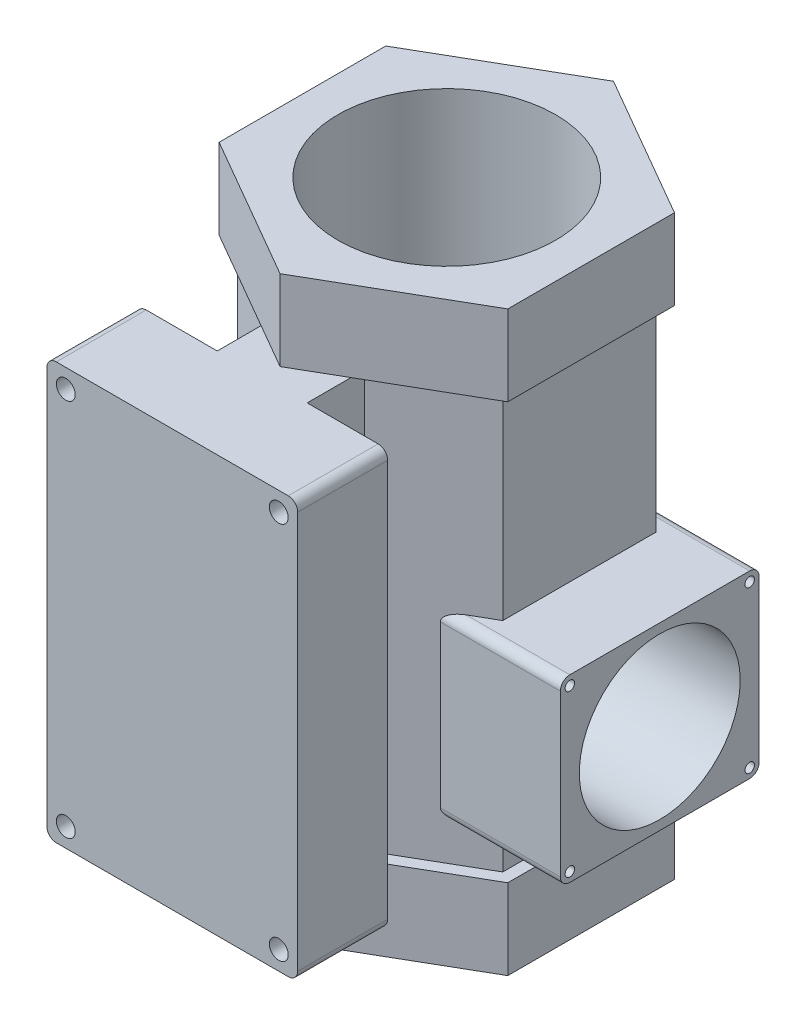
from build123d import *

# Parameters (mm, degrees)
EXTRUDE_1_DEPTH             = 85
EXTRUDE_798_DEPTH           = 440
EXTRUDE_2_DEPTH             = 85
EXTRUDE_1413_DEPTH          = 85
EXTRUDE_1413_DEPTH_BACK     = 140
SKETCH_10_W                 = 210
SKETCH_10_H                 = 190
SKETCH_5_R                  = 115
CUT_EXTRUDE_1475_DEPTH      = 712.91642768
CUT_EXTRUDE_1609_REACH      = 710.683
CUT_EXTRUDE_1609_END_RADIUS = 115
SKETCH_12_R                 = 85
CUT_EXTRUDE_2000_REACH      = 739.219
SKETCH_13_R                 = 10
SKETCH_14_R                 = 5
CUT_EXTRUDE_6_DEPTH         = 30
FILLET_2_R                  = 10
FILLET_3_R                  = 10


with BuildPart() as part:
    # Эскиз2 → Боковой многогранник 1 (new body)
    with BuildSketch(Plane(origin=(0, 0, 0), x_dir=(1, 0, 0), z_dir=(0, 1, 0))):
        Polygon((0, 176.091832103), (-152.5, 88.045916051), (-152.5, -88.045916051), (0, -176.091832103), (152.5, -88.045916051), (152.5, 88.045916051), align=None)
    extrude(amount=EXTRUDE_1_DEPTH)

    # Sketch 344 → Extrude 798 (add)
    with BuildSketch(Plane(origin=(0, 0, 0), x_dir=(1, 0, 0), z_dir=(0, 1, 0))):
        Polygon((0, 161.658075373), (-140, 80.829037687), (-140, -80.829037687), (-47.5, -134.233937587), (-47.5, -195), (-132.5, -195), (-132.5, -290), (132.5, -290), (132.5, -195), (47.5, -195), (47.5, -134.233937587), (140, -80.829037687), (140, 80.829037687), align=None)
    extrude(amount=-EXTRUDE_798_DEPTH)

    # Эскиз4 → Боковой многогранник 2 (add)
    with BuildSketch(Plane.XZ.offset(440)):
        Polygon((0, -176.091832103), (152.5, -88.045916051), (152.5, 88.045916051), (0, 176.091832103), (-152.5, 88.045916051), (-152.5, -88.045916051), align=None)
    extrude(amount=EXTRUDE_2_DEPTH)

    # Эскиз10 → Extrude 1413 (add, two sides: drawn at the far end of the back side and taken through both)
    with BuildSketch(Plane(origin=(140, 0, 0), x_dir=(0, 0, -1), z_dir=(1, 0, 0)).offset(-EXTRUDE_1413_DEPTH_BACK)):
        with Locations((0, -305)):
            Rectangle(SKETCH_10_W, SKETCH_10_H)
    extrude(amount=EXTRUDE_1413_DEPTH + EXTRUDE_1413_DEPTH_BACK)

    # Эскиз5 → Cut-Extrude 1475 (cut, through all)
    with BuildSketch(Plane(origin=(0, 85, 0), x_dir=(1, 0, 0), z_dir=(0, 1, 0))):
        with Locations(Location((0, 0, 0), (0, 0, 270))):
            Circle(SKETCH_5_R)
    extrude(amount=-CUT_EXTRUDE_1475_DEPTH, mode=Mode.SUBTRACT)

    # Cut-Extrude 1609: up to this cylinder (the profile starts outside it)
    cut_extrude_1609_end = Plane(origin=(0, -305, 0), z_dir=(0, 1, 0)) * Cylinder(CUT_EXTRUDE_1609_END_RADIUS, 1652.366, mode=Mode.PRIVATE)
    # Эскиз12 → Cut-Extrude 1609 (cut, up to the surface)
    with BuildSketch(Plane(origin=(225, 0, 0), x_dir=(0, 0, -1), z_dir=(1, 0, 0)), mode=Mode.PRIVATE) as cut_extrude_1609_sk1:
        with Locations((0, -305)):
            Circle(SKETCH_12_R)
    cut_extrude_1609_tool1 = extrude(cut_extrude_1609_sk1.sketch, amount=-CUT_EXTRUDE_1609_REACH, mode=Mode.PRIVATE) - cut_extrude_1609_end
    add(cut_extrude_1609_tool1.solids().sort_by_distance((225, -305, 0))[0], mode=Mode.SUBTRACT)

    # Эскиз13 → Cut-Extrude 2000 (cut, up to next)
    with BuildSketch(Plane.XY.offset(290), mode=Mode.PRIVATE) as cut_extrude_2000_sk1:
        with Locations((-112.5, -420)):
            Circle(SKETCH_13_R)
    cut_extrude_2000_tool1 = extrude(cut_extrude_2000_sk1.sketch, amount=-CUT_EXTRUDE_2000_REACH, mode=Mode.PRIVATE) & part.part
    # Эскиз13 → Cut-Extrude 2000 (cut, up to next)
    with BuildSketch(Plane.XY.offset(290), mode=Mode.PRIVATE) as cut_extrude_2000_sk2:
        with Locations((112.5, -420)):
            Circle(SKETCH_13_R)
    cut_extrude_2000_tool2 = extrude(cut_extrude_2000_sk2.sketch, amount=-CUT_EXTRUDE_2000_REACH, mode=Mode.PRIVATE) & part.part
    # Эскиз13 → Cut-Extrude 2000 (cut, up to next)
    with BuildSketch(Plane.XY.offset(290), mode=Mode.PRIVATE) as cut_extrude_2000_sk3:
        with Locations((-112.5, -20)):
            Circle(SKETCH_13_R)
    cut_extrude_2000_tool3 = extrude(cut_extrude_2000_sk3.sketch, amount=-CUT_EXTRUDE_2000_REACH, mode=Mode.PRIVATE) & part.part
    # Эскиз13 → Cut-Extrude 2000 (cut, up to next)
    with BuildSketch(Plane.XY.offset(290), mode=Mode.PRIVATE) as cut_extrude_2000_sk4:
        with Locations((112.5, -20)):
            Circle(SKETCH_13_R)
    cut_extrude_2000_tool4 = extrude(cut_extrude_2000_sk4.sketch, amount=-CUT_EXTRUDE_2000_REACH, mode=Mode.PRIVATE) & part.part
    add(cut_extrude_2000_tool1.solids().sort_by_distance((-112.5, -420, 290))[0], mode=Mode.SUBTRACT)
    add(cut_extrude_2000_tool2.solids().sort_by_distance((112.5, -420, 290))[0], mode=Mode.SUBTRACT)
    add(cut_extrude_2000_tool3.solids().sort_by_distance((-112.5, -20, 290))[0], mode=Mode.SUBTRACT)
    add(cut_extrude_2000_tool4.solids().sort_by_distance((112.5, -20, 290))[0], mode=Mode.SUBTRACT)

    # Эскиз14 → Вырез-Вытянуть6 (cut)
    with BuildSketch(Plane(origin=(225, 0, 0), x_dir=(0, 0, -1), z_dir=(1, 0, 0))):
        with Locations((95, -220)):
            Circle(SKETCH_14_R)
        with Locations((95, -390)):
            Circle(SKETCH_14_R)
        with Locations((-95, -220)):
            Circle(SKETCH_14_R)
        with Locations((-95, -390)):
            Circle(SKETCH_14_R)
    extrude(amount=-CUT_EXTRUDE_6_DEPTH, mode=Mode.SUBTRACT)

    # Скругление2
    fillet_2_edges = [part.edges().sort_by_distance(p)[0] for p in [
        (132.5, -440, 242.5),
        (-132.5, -440, 242.5),
        (-132.5, 0, 242.5),
        (132.5, 0, 242.5),
    ]]
    fillet(fillet_2_edges, radius=FILLET_2_R)

    # Скругление3
    fillet_3_edges = [part.edges().sort_by_distance(p)[0] for p in [
        (161.567332603, -210, -105),
        (161.567332603, -400, -105),
        (161.567332603, -400, 105),
        (161.567332603, -210, 105),
    ]]
    fillet(fillet_3_edges, radius=FILLET_3_R)


solid = part.part
